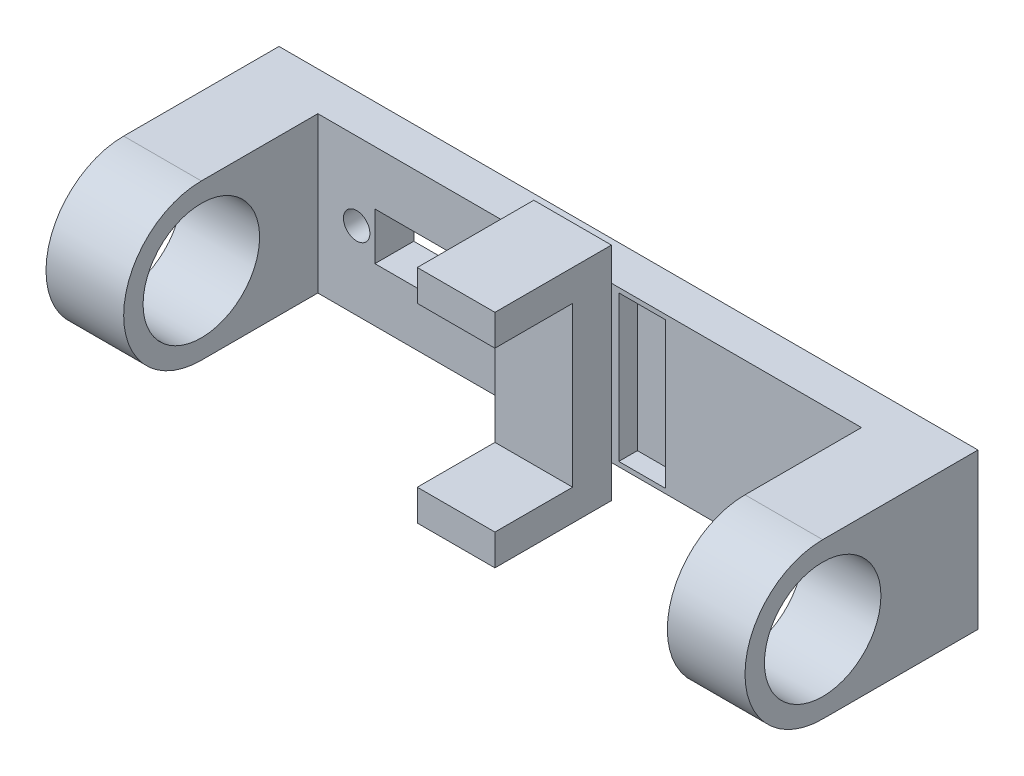
from build123d import *

# Parameters (mm, degrees)
ESQUISSE1_W             = 90
ESQUISSE1_H             = 20
BOSS_EXTRU_1_DEPTH      = 5
ESQUISSE2_W             = 10
ESQUISSE2_H             = 20
BOSS_EXTRU_2_DEPTH      = 30
ESQUISSE3_R             = 7.5
ENL_V_MAT_EXTRU_1_DEPTH = 10
ESQUISSE5_W             = 6
ESQUISSE5_H             = 18.8
ENL_V_MAT_EXTRU_2_DEPTH = 2.4
ESQUISSE10_W            = 15
ESQUISSE10_H            = 6.1
ENL_V_MAT_EXTRU_4_DEPTH = 5
ESQUISSE11_R            = 1
ENL_V_MAT_EXTRU_5_DEPTH = 10
D_GAGEMENT_M31_D        = 3.4
ESQUISSE14_W            = 10
ESQUISSE14_H            = 28.5
BOSS_EXTRU_3_DEPTH      = 5
ESQUISSE16_W            = 10
ESQUISSE16_H            = 4
BOSS_EXTRU_4_DEPTH      = 10


with BuildPart() as part:
    # Esquisse1 → Boss.-Extru.1 (new body)
    with BuildSketch(Plane.XY):
        with Locations((45, 10)):
            Rectangle(ESQUISSE1_W, ESQUISSE1_H)
    extrude(amount=BOSS_EXTRU_1_DEPTH)

    # Esquisse2 → Boss.-Extru.2 (add)
    with BuildSketch(Plane.XY.offset(5)):
        with Locations((5, 10)):
            Rectangle(ESQUISSE2_W, ESQUISSE2_H)
    boss_extru_2 = extrude(amount=BOSS_EXTRU_2_DEPTH)

    # Esquisse3 → Enlèv. mat.-Extru.1 (cut)
    with BuildSketch(Plane.ZY):
        with Locations((20, 10)):
            Circle(ESQUISSE3_R)
        with BuildLine():
            Line((35, 20), (20, 20))
            ThreePointArc((20, 20), (30, 10), (20, 0))
            Line((20, 0), (35, 0))
            Line((35, 0), (35, 20))
        make_face()
    enl_v_mat_extru_1 = extrude(amount=-ENL_V_MAT_EXTRU_1_DEPTH, mode=Mode.SUBTRACT)

    # Symétrie1: Boss.-Extru.2, Enlèv. mat.-Extru.1 across plane
    add(boss_extru_2.mirror(Plane(origin=(45, 0, 0), x_dir=(0, 0, 1), z_dir=(1, 0, 0))))
    add(enl_v_mat_extru_1.mirror(Plane(origin=(45, 0, 0), x_dir=(0, 0, 1), z_dir=(1, 0, 0))), mode=Mode.SUBTRACT)

    # Esquisse5 → Enlèv. mat.-Extru.2 (cut)
    with BuildSketch(Plane.XY.offset(5)):
        with Locations((51.75, 10)):
            Rectangle(ESQUISSE5_W, ESQUISSE5_H)
    extrude(amount=-ENL_V_MAT_EXTRU_2_DEPTH, mode=Mode.SUBTRACT)

    # Esquisse10 → Enlèv. mat.-Extru.4 (cut)
    with BuildSketch(Plane.XY.offset(5)):
        with Locations((24.85, 10)):
            Rectangle(ESQUISSE10_W, ESQUISSE10_H)
    extrude(amount=-ENL_V_MAT_EXTRU_4_DEPTH, mode=Mode.SUBTRACT)

    # Esquisse11 → Enlèv. mat.-Extru.5 (cut)
    with BuildSketch(Plane.XY.offset(5)):
        with Locations((15, 10)):
            Circle(ESQUISSE11_R)
        with Locations((75, 10)):
            Circle(ESQUISSE11_R)
    extrude(amount=-ENL_V_MAT_EXTRU_5_DEPTH, mode=Mode.SUBTRACT)

    # Dégagement M31 (through all)
    with Locations(Plane.XY.offset(5)):
        with Locations((15, 10), (75, 10)):
            Hole(D_GAGEMENT_M31_D / 2)

    # Esquisse14 → Boss.-Extru.3 (add)
    with BuildSketch(Plane.XY.offset(5)):
        with Locations((42.803073496, 10.001209338)):
            Rectangle(ESQUISSE14_W, ESQUISSE14_H)
    extrude(amount=BOSS_EXTRU_3_DEPTH)

    # Esquisse16 → Boss.-Extru.4 (add)
    with BuildSketch(Plane.XY.offset(10)):
        with Locations((42.803073496, 22.251209338)):
            Rectangle(ESQUISSE16_W, ESQUISSE16_H)
        with Locations((42.803073496, -2.248790662)):
            Rectangle(ESQUISSE16_W, ESQUISSE16_H)
    extrude(amount=BOSS_EXTRU_4_DEPTH)


solid = part.part
